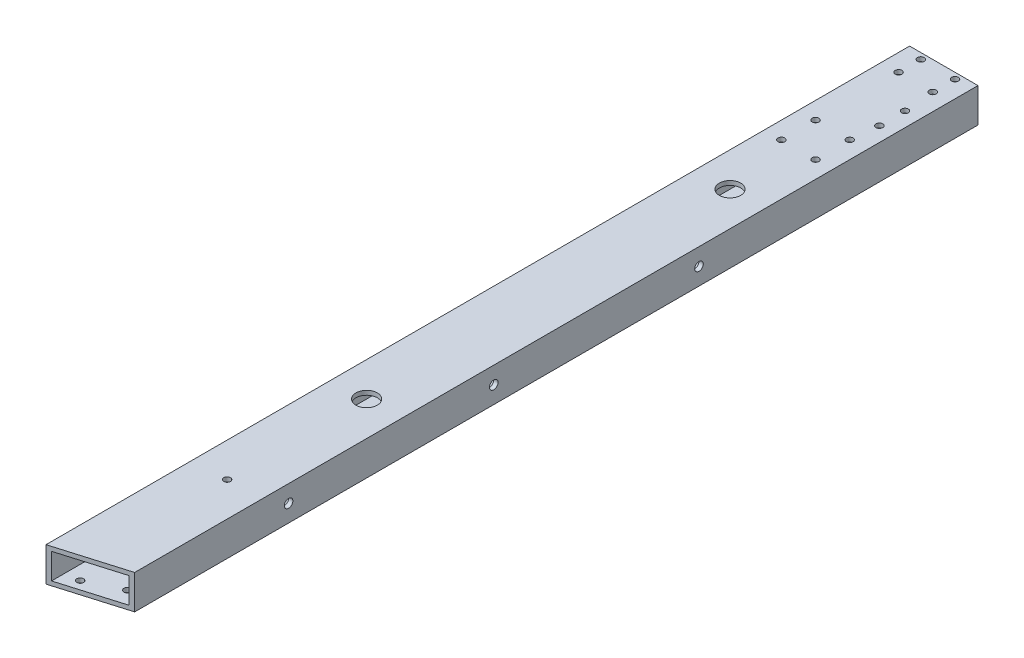
from build123d import *

# Parameters (mm, degrees)
BOSS_EXTRUDE1_DEPTH              = 320.675
BOSS_EXTRUDE1_DEPTH_BACK         = 320.675
SKETCH3_W                        = 50.8
SKETCH3_H                        = 25.4
SKETCH3_W_2                      = 44.45
SKETCH3_H_2                      = 19.05
CUT_EXTRUDE1_DEPTH               = 323.680609311
CUT_EXTRUDE1_DEPTH_BACK          = 323.680609311
F_10_CLEARANCE_HOLE1_D           = 4.9784
F_10_CLEARANCE_HOLE1_DEPTH       = 5.08
F_10_CLEARANCE_HOLE1_TIP         = 1.495662253
F_10_CLEARANCE_HOLE2_D           = 4.9784
F_10_CLEARANCE_HOLE2_DEPTH       = 5.08
F_10_CLEARANCE_HOLE2_TIP         = 1.495662253
F_10_CLEARANCE_HOLE3_D           = 4.9784
F_10_CLEARANCE_HOLE4_D           = 4.9784
F_1_4_CLEARANCE_HOLE1_D          = 6.5278
F_1_4_CLEARANCE_HOLE1_DEPTH      = 5.08
F_1_4_CLEARANCE_HOLE1_TIP        = 1.961148974
F_1_4_0_25_DIAMETER_HOLE1_D      = 6.35
F_1_4_0_25_DIAMETER_HOLE1_DEPTH  = 5.08
F_1_4_0_25_DIAMETER_HOLE1_TIP    = 1.907732465
F_10_CLEARANCE_HOLE5_D           = 4.9784
F_10_CLEARANCE_HOLE5_DEPTH       = 5.08
F_10_CLEARANCE_HOLE5_CSINK_D     = 10.4394
F_10_CLEARANCE_HOLE5_CSINK_ANGLE = 82
F_10_CLEARANCE_HOLE5_TIP         = 1.495662253
SKETCH26_R                       = 7.9375
CUT_EXTRUDE2_DEPTH               = 323.44622226


with BuildPart() as part:
    # Sketch3 → Boss-Extrude1 (new, two sides: drawn at the far end of the back side and taken through both)
    with BuildSketch(Plane.XY.offset(-BOSS_EXTRUDE1_DEPTH_BACK)):
        Rectangle(SKETCH3_W, SKETCH3_H)
        Rectangle(SKETCH3_W_2, SKETCH3_H_2, mode=Mode.SUBTRACT)
    extrude(amount=BOSS_EXTRUDE1_DEPTH + BOSS_EXTRUDE1_DEPTH_BACK)

    # Sketch4 → Cut-Extrude1 (cut, two sides: drawn at the far end of the back side and taken through both)
    with BuildSketch(Plane(origin=(0, 12.7, 0), x_dir=(1, 0, 0), z_dir=(0, 1, 0)).offset(-CUT_EXTRUDE1_DEPTH_BACK)):
        Polygon((1322.117470931, -320.675), (25.4, -320.675), (-25.4, -320.675), (25.4, -305.627354456), (1268.718301677, 62.660305034), (3837.350959621, 420.474595165), (3890.750128875, 37.139290131), align=None)
    extrude(amount=CUT_EXTRUDE1_DEPTH + CUT_EXTRUDE1_DEPTH_BACK, mode=Mode.SUBTRACT)

    # #10 Clearance Hole1
    with Locations(Plane(origin=(0, -12.7, 0), x_dir=(-1, 0, 0), z_dir=(0, -1, 0))):
        with Locations((-11.811, -264.460593775), (11.811, -275.746327933), (-11.811, -297.574221755), (11.811, -308.859955913)):
            Hole(F_10_CLEARANCE_HOLE1_D / 2, depth=F_10_CLEARANCE_HOLE1_DEPTH)
            with Locations((0, 0, -(F_10_CLEARANCE_HOLE1_DEPTH + F_10_CLEARANCE_HOLE1_TIP / 2))):  # 118° drill point
                Cone(0, F_10_CLEARANCE_HOLE1_D / 2, F_10_CLEARANCE_HOLE1_TIP, mode=Mode.SUBTRACT)

    # #10 Clearance Hole2
    with Locations(Plane(origin=(0, 12.7, 0), x_dir=(1, 0, 0), z_dir=(0, 1, 0))):
        with Locations((12.7762, 299.72), (-12.6238, 299.72), (12.7762, 316.23), (-12.6238, 316.23)):
            Hole(F_10_CLEARANCE_HOLE2_D / 2, depth=F_10_CLEARANCE_HOLE2_DEPTH)
            with Locations((0, 0, -(F_10_CLEARANCE_HOLE2_DEPTH + F_10_CLEARANCE_HOLE2_TIP / 2))):  # 118° drill point
                Cone(0, F_10_CLEARANCE_HOLE2_D / 2, F_10_CLEARANCE_HOLE2_TIP, mode=Mode.SUBTRACT)

    # #10 Clearance Hole3 (through all)
    with Locations(Plane(origin=(0, 12.7, 0), x_dir=(1, 0, 0), z_dir=(0, 1, 0))):
        with Locations((-12.7, 212.725), (12.7, 212.725), (12.7, 238.125), (-12.7, 238.125), (14.622625311, 277.25194622), (14.622625311, 258.20194622)):
            Hole(F_10_CLEARANCE_HOLE3_D / 2)

    # #10 Clearance Hole4 (through all)
    with Locations(Plane(origin=(0, 12.7, 0), x_dir=(1, 0, 0), z_dir=(0, 1, 0))):
        with Locations((0, -211.551177228)):
            Hole(F_10_CLEARANCE_HOLE4_D / 2)

    # 1/4 Clearance Hole1
    with Locations(Plane(origin=(0, -12.7, 0), x_dir=(-1, 0, 0), z_dir=(0, -1, 0))):
        with Locations((-10.8204, -96.8375), (-10.8204, -119.0625), (10.8204, -119.0625), (10.8204, -96.8375), (10.8204, 173.0375), (-10.8204, 173.0375), (-10.8204, 150.8125), (10.8204, 150.8125)):
            Hole(F_1_4_CLEARANCE_HOLE1_D / 2, depth=F_1_4_CLEARANCE_HOLE1_DEPTH)
            with Locations((0, 0, -(F_1_4_CLEARANCE_HOLE1_DEPTH + F_1_4_CLEARANCE_HOLE1_TIP / 2))):  # 118° drill point
                Cone(0, F_1_4_CLEARANCE_HOLE1_D / 2, F_1_4_CLEARANCE_HOLE1_TIP, mode=Mode.SUBTRACT)

    # 1/4 (0.25) Diameter Hole1
    with Locations(Plane(origin=(25.4, 0, 0), x_dir=(0, 0, -1), z_dir=(1, 0, 0))):
        with Locations((-191.327354456, 0), (-38.927354456, 0), (113.472645544, 0)):
            Hole(F_1_4_0_25_DIAMETER_HOLE1_D / 2, depth=F_1_4_0_25_DIAMETER_HOLE1_DEPTH)
            with Locations((0, 0, -(F_1_4_0_25_DIAMETER_HOLE1_DEPTH + F_1_4_0_25_DIAMETER_HOLE1_TIP / 2))):  # 118° drill point
                Cone(0, F_1_4_0_25_DIAMETER_HOLE1_D / 2, F_1_4_0_25_DIAMETER_HOLE1_TIP, mode=Mode.SUBTRACT)

    # #10 Clearance Hole5
    with Locations(Plane(origin=(0, -12.7, 0), x_dir=(-1, 0, 0), z_dir=(0, -1, 0))):
        with Locations((0, -107.95), (0, 161.925)):
            CounterSinkHole(F_10_CLEARANCE_HOLE5_D / 2, F_10_CLEARANCE_HOLE5_CSINK_D / 2, depth=F_10_CLEARANCE_HOLE5_DEPTH, counter_sink_angle=F_10_CLEARANCE_HOLE5_CSINK_ANGLE)
            with Locations((0, 0, -(F_10_CLEARANCE_HOLE5_DEPTH + F_10_CLEARANCE_HOLE5_TIP / 2))):  # 118° drill point
                Cone(0, F_10_CLEARANCE_HOLE5_D / 2, F_10_CLEARANCE_HOLE5_TIP, mode=Mode.SUBTRACT)

    # Sketch26 → Cut-Extrude2 (cut, through all)
    with BuildSketch(Plane.XZ.offset(-9.525)):
        with Locations(Location((0, 107.95, 0), (0, 0, 270))):
            Circle(SKETCH26_R)
        with Locations(Location((0, -161.925, 0), (0, 0, 270))):
            Circle(SKETCH26_R)
    extrude(amount=-CUT_EXTRUDE2_DEPTH, mode=Mode.SUBTRACT)


solid = part.part
